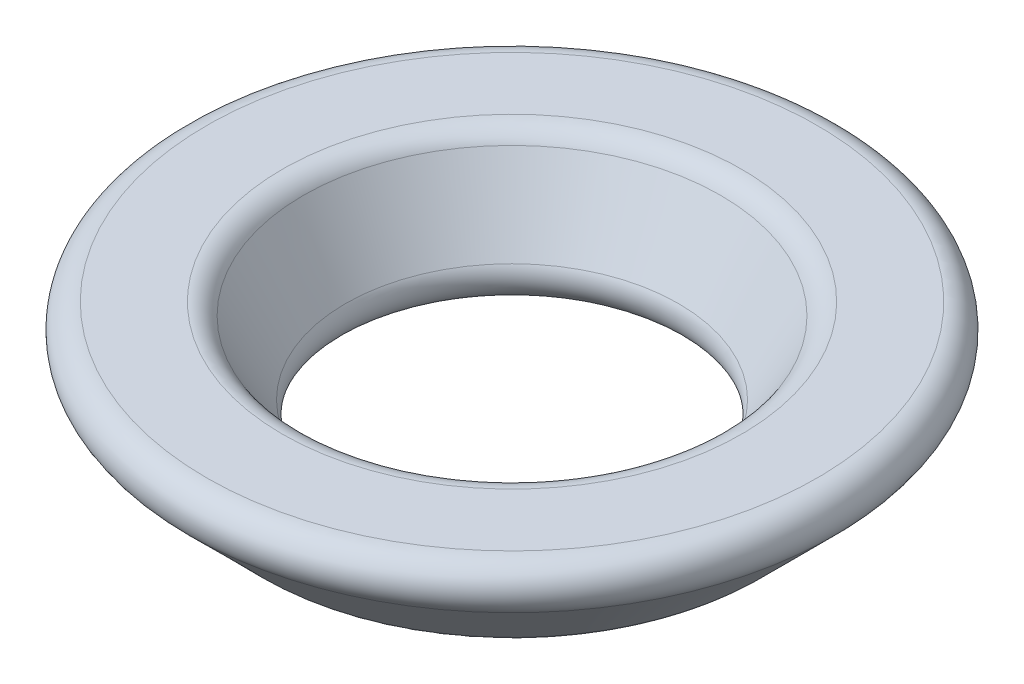
from build123d import *

# Parameters (mm, degrees)
FILLET1_R = 1.27


with BuildPart() as part:
    # Sketch1 → Revolve1 (revolve)
    with BuildSketch(Plane.XY, mode=Mode.PRIVATE) as revolve1_sk:
        Polygon((-12.7, 0), (-19.05, 6.35), (-11.286174209, 6.35), (-7.62, 0), align=None)
    revolve(revolve1_sk.sketch.rotate(Axis((0, 6.6675, 0), (0, -1, 0)), 270), axis=Axis((0, 6.6675, 0), (0, -1, 0)))

    # Fillet1
    fillet1_edges = [part.edges().sort_by_distance(p)[0] for p in [
        (0, 0, -12.7),
        (0, 6.35, -19.05),
        (0, 6.35, -11.286174209),
        (0, 0, -7.62),
    ]]
    fillet(fillet1_edges, radius=FILLET1_R)


solid = part.part
